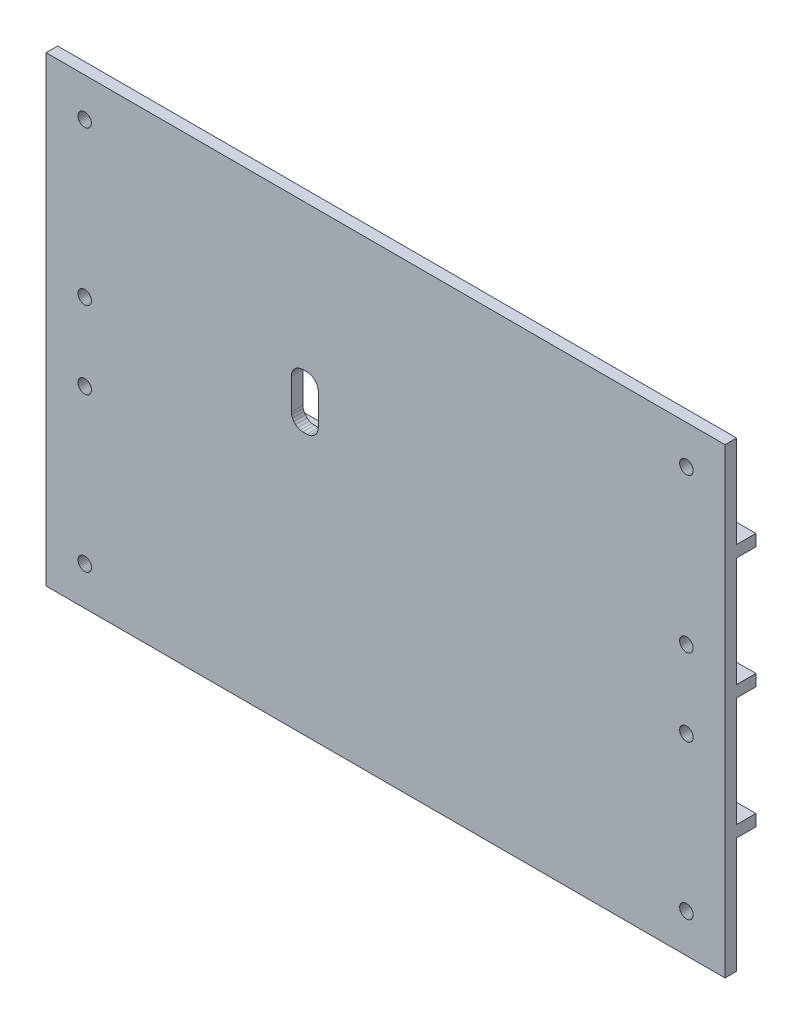
from build123d import *

# Parameters (mm, degrees)
SKETCH_1_W           = 175.799995661
SKETCH_1_H           = 119.599997997
EXTRUDE_1_DEPTH      = 7.999999914
SKETCH_2_W           = 4.999999888
SKETCH_2_H           = 29.899999499
CUT_EXTRUDE_1_DEPTH  = 213.684738508
SKETCH_3_W           = 4.999999888
SKETCH_3_H           = 23.900000378
CUT_EXTRUDE_2_DEPTH  = 213.684738508
SKETCH_4_W           = 4.999999888
SKETCH_4_H           = 28.400002047
CUT_EXTRUDE_3_DEPTH  = 213.684738508
SKETCH_5_W           = 4.999999888
SKETCH_5_H           = 28.400000185
CUT_EXTRUDE_4_DEPTH  = 213.684738508
CUT_EXTRUDE_5_DEPTH  = 213.684738508
CUT_EXTRUDE_6_DEPTH  = 213.684738508
CUT_EXTRUDE_7_DEPTH  = 213.776403753
CUT_EXTRUDE_8_DEPTH  = 213.684738508
CUT_EXTRUDE_9_DEPTH  = 213.776403753
CUT_EXTRUDE_10_DEPTH = 213.684738508
CUT_EXTRUDE_11_DEPTH = 213.776403753
CUT_EXTRUDE_12_DEPTH = 213.684738508
CUT_EXTRUDE_13_DEPTH = 213.684738508


with BuildPart() as part:
    # 草图1 → 凸台-拉伸1 (new body)
    with BuildSketch(Plane(origin=(0, 0, -4.999999888), x_dir=(-1, 0, 0), z_dir=(0, 0, -1))):
        with Locations((-87.89999783, -59.799998999)):
            Rectangle(SKETCH_1_W, SKETCH_1_H)
    extrude(amount=-EXTRUDE_1_DEPTH)

    # 草图2 → 切除-拉伸1 (cut, through all)
    with BuildSketch(Plane(origin=(175.799995661, 0, 0), x_dir=(0, 0, -1), z_dir=(1, 0, 0))):
        with Locations((2.499999944, -104.649998248)):
            Rectangle(SKETCH_2_W, SKETCH_2_H)
    extrude(amount=-CUT_EXTRUDE_1_DEPTH, mode=Mode.SUBTRACT)

    # 草图3 → 切除-拉伸2 (cut, through all)
    with BuildSketch(Plane(origin=(175.799995661, 0, 0), x_dir=(0, 0, -1), z_dir=(1, 0, 0))):
        with Locations((2.499999944, -11.950000189)):
            Rectangle(SKETCH_3_W, SKETCH_3_H)
    extrude(amount=-CUT_EXTRUDE_2_DEPTH, mode=Mode.SUBTRACT)

    # 草图4 → 切除-拉伸3 (cut, through all)
    with BuildSketch(Plane(origin=(175.799995661, 0, 0), x_dir=(0, 0, -1), z_dir=(1, 0, 0))):
        with Locations((2.499999944, -41.100000032)):
            Rectangle(SKETCH_4_W, SKETCH_4_H)
    extrude(amount=-CUT_EXTRUDE_3_DEPTH, mode=Mode.SUBTRACT)

    # 草图5 → 切除-拉伸4 (cut, through all)
    with BuildSketch(Plane(origin=(175.799995661, 0, 0), x_dir=(0, 0, -1), z_dir=(1, 0, 0))):
        with Locations((2.499999944, -72.499999777)):
            Rectangle(SKETCH_5_W, SKETCH_5_H)
    extrude(amount=-CUT_EXTRUDE_4_DEPTH, mode=Mode.SUBTRACT)

    # 草图6 → 切除-拉伸5 (cut, through all)
    with BuildSketch(Plane(origin=(0, 0, 0), x_dir=(-1, 0, 0), z_dir=(0, 0, -1))):
        Polygon((-9.725720622, -48.071648926), (-9.999999776, -48.050601035), (-10.274279863, -48.071648926), (-10.540035553, -48.13599214), (-10.795401409, -48.241384327), (-11.027524248, -48.383943737), (-11.238025501, -48.563633114), (-11.414877139, -48.770554364), (-11.55920513, -49.006503075), (-11.663941666, -49.258068204), (-11.727053672, -49.521725625), (-11.749999598, -49.800001085), (-11.727053672, -50.07827282), (-11.663941666, -50.34193024), (-11.55920513, -50.593495369), (-11.414877139, -50.829447806), (-11.238025501, -51.036369056), (-11.027524248, -51.216054708), (-10.795401409, -51.358617842), (-10.540035553, -51.46401003), (-10.274279863, -51.528349519), (-9.999999776, -51.549397409), (-9.725720622, -51.528349519), (-9.459964931, -51.46401003), (-9.204598144, -51.358617842), (-8.972476237, -51.216054708), (-8.761974052, -51.036369056), (-8.585123345, -50.829447806), (-8.440795355, -50.593495369), (-8.336058818, -50.34193024), (-8.272946812, -50.07827282), (-8.249999955, -49.800001085), (-8.272946812, -49.521725625), (-8.336058818, -49.258068204), (-8.440795355, -49.006503075), (-8.585123345, -48.770554364), (-8.761974052, -48.563633114), (-8.972476237, -48.383943737), (-9.204598144, -48.241384327), (-9.459964931, -48.13599214), align=None)
    extrude(amount=-CUT_EXTRUDE_5_DEPTH, mode=Mode.SUBTRACT)

    # 草图7 → 切除-拉伸6 (cut, through all)
    with BuildSketch(Plane(origin=(0, 0, 0), x_dir=(-1, 0, 0), z_dir=(0, 0, -1))):
        Polygon((-67.500002682, -37.799999118), (-68.168774247, -37.875529379), (-68.802267313, -38.097634912), (-69.370523095, -38.454949856), (-69.845058024, -38.929481059), (-70.202372968, -39.497733116), (-70.424467325, -40.131226182), (-70.500001311, -40.799997747), (-70.500001311, -48.799999058), (-70.424467325, -49.468774348), (-70.202372968, -50.102267414), (-69.845058024, -50.670519471), (-69.370523095, -51.145050675), (-68.802267313, -51.502369344), (-68.168774247, -51.724471152), (-67.500002682, -51.799997687), (-66.500000656, -51.799997687), (-65.83122164, -51.724471152), (-65.197728574, -51.502369344), (-64.629480243, -51.145050675), (-64.154945314, -50.670519471), (-63.79763782, -50.102267414), (-63.575528562, -49.468774348), (-63.500002027, -48.799999058), (-63.500002027, -40.799997747), (-63.575528562, -40.131226182), (-63.79763782, -39.497733116), (-64.154945314, -38.929481059), (-64.629480243, -38.454949856), (-65.197728574, -38.097634912), (-65.83122164, -37.875529379), (-66.500000656, -37.799999118), align=None)
    extrude(amount=-CUT_EXTRUDE_6_DEPTH, mode=Mode.SUBTRACT)

    # 草图8 → 切除-拉伸7 (cut, through all)
    with BuildSketch(Plane.XY.offset(3.000000026)):
        Polygon((167.463943362, -49.258068204), (167.3592031, -49.006503075), (167.214870453, -48.770554364), (167.038023472, -48.563633114), (166.827529669, -48.383943737), (166.59539938, -48.241384327), (166.34003818, -48.13599214), (166.07427597, -48.071648926), (165.800005198, -48.050601035), (165.525719523, -48.071648926), (165.259957314, -48.13599214), (165.004596114, -48.241384327), (164.772480726, -48.383943737), (164.561986923, -48.563633114), (164.38511014, -48.770554364), (164.240792394, -49.006503075), (164.136067033, -49.258068204), (164.072945714, -49.521725625), (164.049997926, -49.800001085), (164.072945714, -50.07827282), (164.136067033, -50.34193024), (164.240792394, -50.593495369), (164.38511014, -50.829447806), (164.561986923, -51.036369056), (164.772480726, -51.216054708), (165.004596114, -51.358617842), (165.259957314, -51.46401003), (165.525719523, -51.528349519), (165.800005198, -51.549397409), (166.07427597, -51.528349519), (166.34003818, -51.46401003), (166.59539938, -51.358617842), (166.827529669, -51.216054708), (167.038023472, -51.036369056), (167.214870453, -50.829447806), (167.3592031, -50.593495369), (167.463943362, -50.34193024), (167.52704978, -50.07827282), (167.549997568, -49.800001085), (167.52704978, -49.521725625), align=None)
    extrude(amount=-CUT_EXTRUDE_7_DEPTH, mode=Mode.SUBTRACT)

    # 草图9 → 切除-拉伸8 (cut, through all)
    with BuildSketch(Plane(origin=(0, 0, 0), x_dir=(-1, 0, 0), z_dir=(0, 0, -1))):
        Polygon((-8.249999955, -9.999999776), (-8.272946812, -9.721725248), (-8.336058818, -9.45806969), (-8.440795355, -9.206505492), (-8.585123345, -8.970551193), (-8.761974052, -8.763630874), (-8.972476237, -8.583946154), (-9.204598144, -8.441382088), (-9.459964931, -8.335992694), (-9.725720622, -8.27164948), (-9.999999776, -8.250602521), (-10.274279863, -8.27164948), (-10.540035553, -8.335992694), (-10.795401409, -8.441382088), (-11.027524248, -8.583946154), (-11.238025501, -8.763630874), (-11.414877139, -8.970551193), (-11.55920513, -9.206505492), (-11.663941666, -9.45806969), (-11.727053672, -9.721725248), (-11.749999598, -9.999999776), (-11.727053672, -10.278274305), (-11.663941666, -10.541929863), (-11.55920513, -10.793494061), (-11.414877139, -11.02944836), (-11.238025501, -11.236368679), (-11.027524248, -11.416053399), (-10.795401409, -11.558617465), (-10.540035553, -11.664006859), (-10.274279863, -11.728351004), (-9.999999776, -11.749397032), (-9.725720622, -11.728351004), (-9.459964931, -11.664006859), (-9.204598144, -11.558617465), (-8.972476237, -11.416053399), (-8.761974052, -11.236368679), (-8.585123345, -11.02944836), (-8.440795355, -10.793494061), (-8.336058818, -10.541929863), (-8.272946812, -10.278274305), align=None)
    extrude(amount=-CUT_EXTRUDE_8_DEPTH, mode=Mode.SUBTRACT)

    # 草图10 → 切除-拉伸9 (cut, through all)
    with BuildSketch(Plane.XY.offset(3.000000026)):
        Polygon((166.07427597, -8.27164948), (165.800005198, -8.250602521), (165.525719523, -8.27164948), (165.259957314, -8.335992694), (165.004596114, -8.441382088), (164.772480726, -8.583946154), (164.561986923, -8.763630874), (164.38511014, -8.970551193), (164.240792394, -9.206505492), (164.136067033, -9.45806969), (164.072945714, -9.721725248), (164.049997926, -9.999999776), (164.072945714, -10.278274305), (164.136067033, -10.541929863), (164.240792394, -10.793494061), (164.38511014, -11.02944836), (164.561986923, -11.236368679), (164.772480726, -11.416053399), (165.004596114, -11.558617465), (165.259957314, -11.664006859), (165.525719523, -11.728351004), (165.800005198, -11.749397032), (166.07427597, -11.728351004), (166.34003818, -11.664006859), (166.59539938, -11.558617465), (166.827529669, -11.416053399), (167.038023472, -11.236368679), (167.214870453, -11.02944836), (167.3592031, -10.793494061), (167.463943362, -10.541929863), (167.52704978, -10.278274305), (167.549997568, -9.999999776), (167.52704978, -9.721725248), (167.463943362, -9.45806969), (167.3592031, -9.206505492), (167.214870453, -8.970551193), (167.038023472, -8.763630874), (166.827529669, -8.583946154), (166.59539938, -8.441382088), (166.34003818, -8.335992694), align=None)
    extrude(amount=-CUT_EXTRUDE_9_DEPTH, mode=Mode.SUBTRACT)

    # 草图11 → 切除-拉伸10 (cut, through all)
    with BuildSketch(Plane(origin=(0, 0, 0), x_dir=(-1, 0, 0), z_dir=(0, 0, -1))):
        Polygon((-11.749999598, -69.800004363), (-11.727053672, -70.078276098), (-11.663941666, -70.341929793), (-11.55920513, -70.593498647), (-11.414877139, -70.829443634), (-11.238025501, -71.036368608), (-11.027524248, -71.216054261), (-10.795401409, -71.35862112), (-10.540035553, -71.464002132), (-10.274279863, -71.528352797), (-9.999999776, -71.549400687), (-9.725720622, -71.528352797), (-9.459964931, -71.464002132), (-9.204598144, -71.35862112), (-8.972476237, -71.216054261), (-8.761974052, -71.036368608), (-8.585123345, -70.829443634), (-8.440795355, -70.593498647), (-8.336058818, -70.341929793), (-8.272946812, -70.078276098), (-8.249999955, -69.800004363), (-8.272946812, -69.521725178), (-8.336058818, -69.258071482), (-8.440795355, -69.006510079), (-8.585123345, -68.770550191), (-8.761974052, -68.563632667), (-8.972476237, -68.383947015), (-9.204598144, -68.241380155), (-9.459964931, -68.135991693), (-9.725720622, -68.071648479), (-9.999999776, -68.050608039), (-10.274279863, -68.071648479), (-10.540035553, -68.135991693), (-10.795401409, -68.241380155), (-11.027524248, -68.383947015), (-11.238025501, -68.563632667), (-11.414877139, -68.770550191), (-11.55920513, -69.006510079), (-11.663941666, -69.258071482), (-11.727053672, -69.521725178), align=None)
    extrude(amount=-CUT_EXTRUDE_10_DEPTH, mode=Mode.SUBTRACT)

    # 草图12 → 切除-拉伸11 (cut, through all)
    with BuildSketch(Plane.XY.offset(3.000000026)):
        Polygon((164.136067033, -69.258071482), (164.072945714, -69.521725178), (164.049997926, -69.800004363), (164.072945714, -70.078276098), (164.136067033, -70.341929793), (164.240792394, -70.593498647), (164.38511014, -70.829443634), (164.561986923, -71.036368608), (164.772480726, -71.216054261), (165.004596114, -71.35862112), (165.259957314, -71.464002132), (165.525719523, -71.528352797), (165.800005198, -71.549400687), (166.07427597, -71.528352797), (166.34003818, -71.464002132), (166.59539938, -71.35862112), (166.827529669, -71.216054261), (167.038023472, -71.036368608), (167.214870453, -70.829443634), (167.3592031, -70.593498647), (167.463943362, -70.341929793), (167.52704978, -70.078276098), (167.549997568, -69.800004363), (167.52704978, -69.521725178), (167.463943362, -69.258071482), (167.3592031, -69.006510079), (167.214870453, -68.770550191), (167.038023472, -68.563632667), (166.827529669, -68.383947015), (166.59539938, -68.241380155), (166.34003818, -68.135991693), (166.07427597, -68.071648479), (165.800005198, -68.050608039), (165.525719523, -68.071648479), (165.259957314, -68.135991693), (165.004596114, -68.241380155), (164.772480726, -68.383947015), (164.561986923, -68.563632667), (164.38511014, -68.770550191), (164.240792394, -69.006510079), align=None)
    extrude(amount=-CUT_EXTRUDE_11_DEPTH, mode=Mode.SUBTRACT)

    # 草图13 → 切除-拉伸12 (cut, through all)
    with BuildSketch(Plane(origin=(0, 0, 0), x_dir=(-1, 0, 0), z_dir=(0, 0, -1))):
        Polygon((-9.725720622, -107.871651649), (-9.999999776, -107.850603759), (-10.274279863, -107.871651649), (-10.540035553, -107.935994864), (-10.795401409, -108.041383326), (-11.027524248, -108.183942735), (-11.238025501, -108.363635838), (-11.414877139, -108.570545912), (-11.55920513, -108.806505799), (-11.663941666, -109.058067203), (-11.727053672, -109.321720898), (-11.749999598, -109.600000083), (-11.727053672, -109.878271818), (-11.663941666, -110.141932964), (-11.55920513, -110.393494368), (-11.414877139, -110.629446805), (-11.238025501, -110.836371779), (-11.027524248, -111.016049981), (-10.795401409, -111.158616841), (-10.540035553, -111.264005303), (-10.274279863, -111.328355968), (-9.999999776, -111.349396408), (-9.725720622, -111.328355968), (-9.459964931, -111.264005303), (-9.204598144, -111.158616841), (-8.972476237, -111.016049981), (-8.761974052, -110.836371779), (-8.585123345, -110.629446805), (-8.440795355, -110.393494368), (-8.336058818, -110.141932964), (-8.272946812, -109.878271818), (-8.249999955, -109.600000083), (-8.272946812, -109.321720898), (-8.336058818, -109.058067203), (-8.440795355, -108.806505799), (-8.585123345, -108.570545912), (-8.761974052, -108.363635838), (-8.972476237, -108.183942735), (-9.204598144, -108.041383326), (-9.459964931, -107.935994864), align=None)
    extrude(amount=-CUT_EXTRUDE_12_DEPTH, mode=Mode.SUBTRACT)

    # 草图14 → 切除-拉伸13 (cut, through all)
    with BuildSketch(Plane(origin=(0, 0, 0), x_dir=(-1, 0, 0), z_dir=(0, 0, -1))):
        Polygon((-165.800005198, -111.349396408), (-165.525719523, -111.328355968), (-165.259957314, -111.264005303), (-165.004596114, -111.158616841), (-164.772480726, -111.016049981), (-164.561986923, -110.836371779), (-164.38511014, -110.629446805), (-164.240792394, -110.393494368), (-164.136067033, -110.141932964), (-164.072945714, -109.878271818), (-164.049997926, -109.600000083), (-164.072945714, -109.321720898), (-164.136067033, -109.058067203), (-164.240792394, -108.806505799), (-164.38511014, -108.570545912), (-164.561986923, -108.363635838), (-164.772480726, -108.183942735), (-165.004596114, -108.041383326), (-165.259957314, -107.935994864), (-165.525719523, -107.871651649), (-165.800005198, -107.850603759), (-166.07427597, -107.871651649), (-166.34003818, -107.935994864), (-166.59539938, -108.041383326), (-166.827529669, -108.183942735), (-167.038023472, -108.363635838), (-167.214870453, -108.570545912), (-167.3592031, -108.806505799), (-167.463943362, -109.058067203), (-167.52704978, -109.321720898), (-167.549997568, -109.600000083), (-167.52704978, -109.878271818), (-167.463943362, -110.141932964), (-167.3592031, -110.393494368), (-167.214870453, -110.629446805), (-167.038023472, -110.836371779), (-166.827529669, -111.016049981), (-166.59539938, -111.158616841), (-166.34003818, -111.264005303), (-166.07427597, -111.328355968), align=None)
    extrude(amount=-CUT_EXTRUDE_13_DEPTH, mode=Mode.SUBTRACT)


solid = part.part
